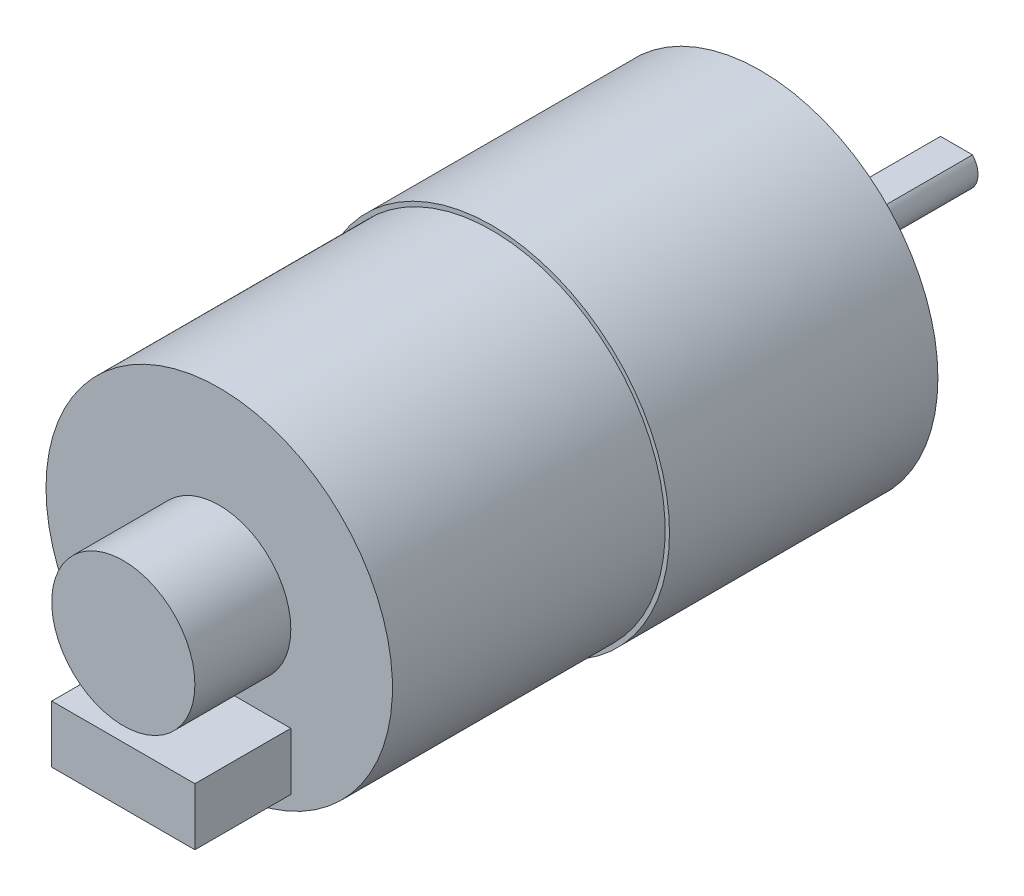
from build123d import *

# Parameters (mm, degrees)
SKETCH_1_R                  = 12.4
EXTRUDE_1_DEPTH             = 18.75
SKETCH_2_R                  = 12.1
EXTRUDE_2_DEPTH             = 19.05
SKETCH_3_R                  = 3.5
EXTRUDE_3_DEPTH             = 2.7
SKETCH_4_R                  = 1.5
EXTRUDE_4_DEPTH             = 11
SKETCH_5_W                  = 3.74465869
SKETCH_5_H                  = 1.716918609
CUT_EXTRUDE_1_DEPTH         = 8
SKETCH_6_R                  = 5
EXTRUDE_5_DEPTH             = 6.7
SKETCH_7_W                  = 10
SKETCH_7_H                  = 4
EXTRUDE_6_DEPTH             = 16.7
HOLE_WIZARD_M3_1_AT_2_COUNT = 2
HOLE_WIZARD_M3_1_AT_2_PITCH = 17


with BuildPart() as part:
    # 草图1 → 凸台-拉伸1 (new body)
    with BuildSketch(Plane.XY):
        Circle(SKETCH_1_R)
    extrude(amount=EXTRUDE_1_DEPTH)

    # 草图2 → 凸台-拉伸2 (add)
    with BuildSketch(Plane.XY.offset(18.75)):
        with Locations(Location((0, 0, 0), (0, 0, 180))):
            Circle(SKETCH_2_R)
    extrude(amount=EXTRUDE_2_DEPTH)

    # 草图3 → 凸台-拉伸3 (add)
    with BuildSketch(Plane(origin=(0, 0, 0), x_dir=(-1, 0, 0), z_dir=(0, 0, -1))):
        with Locations(Location((0, 0, 0), (0, 0, 180))):
            Circle(SKETCH_3_R)
    extrude(amount=EXTRUDE_3_DEPTH)

    # 草图4 → 凸台-拉伸4 (add)
    with BuildSketch(Plane(origin=(0, 0, -2.7), x_dir=(-1, 0, 0), z_dir=(0, 0, -1))):
        Circle(SKETCH_4_R)
    extrude(amount=EXTRUDE_4_DEPTH)

    # 草图5 → 切除-拉伸1 (cut)
    with BuildSketch(Plane(origin=(0, 0, -13.7), x_dir=(-1, 0, 0), z_dir=(0, 0, -1))):
        with Locations((0.301742381, 1.858459305)):
            Rectangle(SKETCH_5_W, SKETCH_5_H)
    extrude(amount=-CUT_EXTRUDE_1_DEPTH, mode=Mode.SUBTRACT)

    # 草图6 → 凸台-拉伸5 (add)
    with BuildSketch(Plane.XY.offset(37.8)):
        Circle(SKETCH_6_R)
    extrude(amount=EXTRUDE_5_DEPTH)

    # 草图9 → M3 螺纹孔1 (revolve, cut)
    with BuildSketch(Plane.YZ.offset(-8.5)):
        Polygon((0, 0), (0, 5), (1.25, 4.248924226), (1.25, 0), align=None)
    hole_wizard_m3_1 = revolve(axis=Axis((-8.5, 0, -6.35), (0, 0, 1)), mode=Mode.SUBTRACT)

    # M3 螺纹孔1 at 2: M3 螺纹孔1 ×2
    with Locations(*[(i * HOLE_WIZARD_M3_1_AT_2_PITCH, 0, 0) for i in range(1, HOLE_WIZARD_M3_1_AT_2_COUNT)]):
        add(hole_wizard_m3_1, mode=Mode.SUBTRACT)


with BuildPart() as body_2:
    # 草图7 → 凸台-拉伸6 (new body)
    with BuildSketch(Plane.XY.offset(44.5)):
        with Locations((0, -8)):
            Rectangle(SKETCH_7_W, SKETCH_7_H)
    extrude(amount=-EXTRUDE_6_DEPTH)


solid = Compound([part.part, body_2.part])
